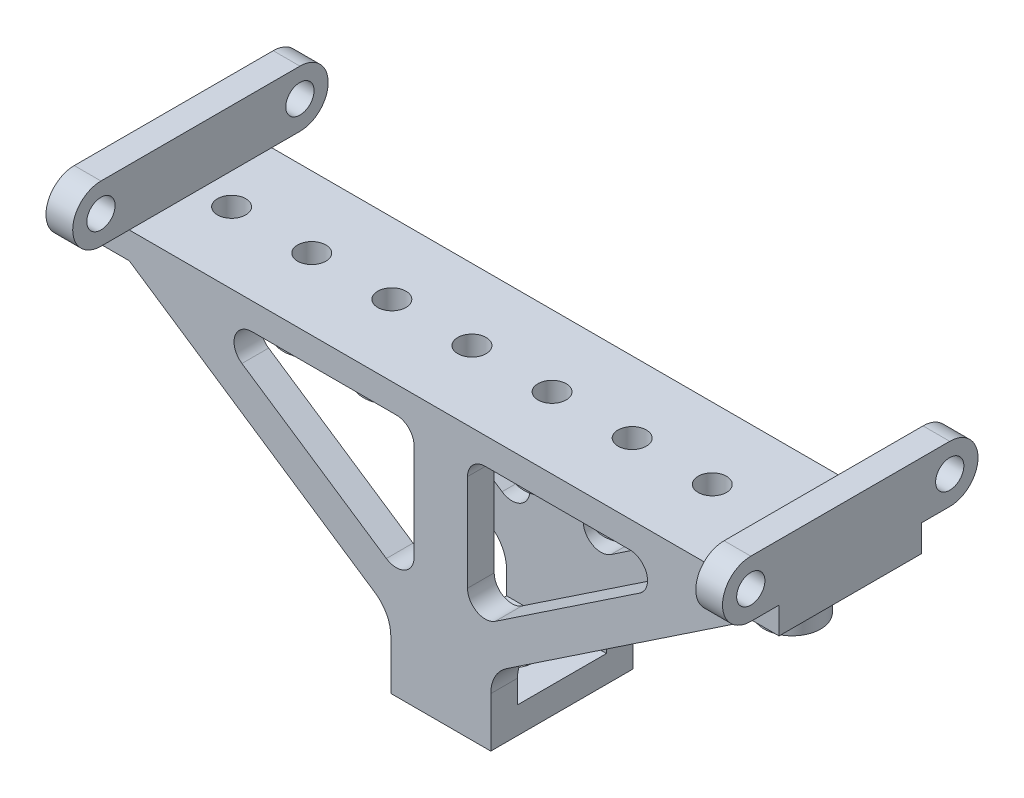
from build123d import *

# Parameters (mm, degrees)
SKETCH1_W            = 70
SKETCH1_H            = 16
SKETCH1_R            = 1.5875
BOSS_EXTRUDE1_DEPTH  = 3
BOSS_EXTRUDE6_DEPTH  = 3
BOSS_EXTRUDE9_START  = -3
BOSS_EXTRUDE9_DEPTH  = 3
SKETCH7_W            = 11.213160903
SKETCH7_H            = 16
SKETCH7_R            = 2.413
BOSS_EXTRUDE10_DEPTH = 3
SKETCH10_R           = 1.5875
BOSS_EXTRUDE11_DEPTH = 3
BOSS_EXTRUDE12_START = 3
SKETCH11_R           = 1.5875
BOSS_EXTRUDE12_DEPTH = 3
SKETCH12_R           = 3.175
SKETCH12_R_2         = 1.5875
BOSS_EXTRUDE13_DEPTH = 5


with BuildPart() as part:
    # Sketch1 → Boss-Extrude1 (new body)
    with BuildSketch(Plane(origin=(0, 0, 0), x_dir=(1, 0, 0), z_dir=(0, 1, 0))):
        Rectangle(SKETCH1_W, SKETCH1_H)
        with Locations(Location((-4.5, 0, 0), (0, 0, 270))):
            Circle(SKETCH1_R, mode=Mode.SUBTRACT)
        with Locations(Location((4.5, 0, 0), (0, 0, 270))):
            Circle(SKETCH1_R, mode=Mode.SUBTRACT)
        with Locations(Location((13.5, 0, 0), (0, 0, 270))):
            Circle(SKETCH1_R, mode=Mode.SUBTRACT)
        with Locations(Location((22.5, 0, 0), (0, 0, 270))):
            Circle(SKETCH1_R, mode=Mode.SUBTRACT)
        with Locations(Location((31.5, 0, 0), (0, 0, 270))):
            Circle(SKETCH1_R, mode=Mode.SUBTRACT)
        with Locations(Location((-13.5, 0, 0), (0, 0, 270))):
            Circle(SKETCH1_R, mode=Mode.SUBTRACT)
        with Locations(Location((-22.5, 0, 0), (0, 0, 270))):
            Circle(SKETCH1_R, mode=Mode.SUBTRACT)
        with Locations(Location((-31.5, 0, 0), (0, 0, 270))):
            Circle(SKETCH1_R, mode=Mode.SUBTRACT)
    extrude(amount=-BOSS_EXTRUDE1_DEPTH)

    # Sketch3 → Boss-Extrude6 (add)
    with BuildSketch(Plane(origin=(0, 0, -8), x_dir=(-1, 0, 0), z_dir=(0, 0, -1))):
        with BuildLine():
            ThreePointArc((-7.390034655, -21.480696382), (-6.086556875, -22.920616292), (-5.615003916, -24.804776975))
            Line((-5.615003916, -24.804776975), (-5.615003916, -30.4))
            Line((-5.615003916, -30.4), (5.615003916, -30.4))
            Line((5.615003916, -30.4), (5.615003916, -24.804776975))
            ThreePointArc((5.615003916, -24.804776975), (6.086556875, -22.920616292), (7.390034655, -21.480696382))
            Line((7.390034655, -21.480696382), (35, -3))
            Line((35, -3), (35, 0))
            Line((35, 0), (-35, 0))
            Line((-35, 0), (-35, -3))
            Line((-35, -3), (-7.390034655, -21.480696382))
        make_face()
        with BuildLine():
            Line((-6.11248463, -17.522461887), (-22.337839864, -6.662040296))
            ThreePointArc((-22.337839864, -6.662040296), (-23.139001046, -4.418656983), (-21.225355233, -3))
            Line((-21.225355233, -3), (-5, -3))
            ThreePointArc((-5, -3), (-3.585786438, -3.585786438), (-3, -5))
            Line((-3, -5), (-3, -15.860421591))
            ThreePointArc((-3, -15.860421591), (-4.057919659, -17.624645111), (-6.11248463, -17.522461887))
        make_face(mode=Mode.SUBTRACT)
        with BuildLine():
            Line((3, -15.860421591), (3, -5))
            ThreePointArc((3, -5), (3.585786438, -3.585786438), (5, -3))
            Line((5, -3), (21.225355233, -3))
            ThreePointArc((21.225355233, -3), (23.139001046, -4.418656983), (22.337839864, -6.662040296))
            Line((22.337839864, -6.662040296), (6.11248463, -17.522461887))
            ThreePointArc((6.11248463, -17.522461887), (4.057919659, -17.624645111), (3, -15.860421591))
        make_face(mode=Mode.SUBTRACT)
    extrude(amount=-BOSS_EXTRUDE6_DEPTH)

    # Sketch6 → Boss-Extrude9 (add)
    with BuildSketch(Plane.XY.offset(8).offset(BOSS_EXTRUDE9_START)):
        with BuildLine():
            ThreePointArc((-7.390034655, -21.480696382), (-6.086556875, -22.920616292), (-5.615003916, -24.804776975))
            Line((-5.615003916, -24.804776975), (-5.615003916, -30.4))
            Line((-5.615003916, -30.4), (5.615003916, -30.4))
            Line((5.615003916, -30.4), (5.615003916, -24.804776975))
            ThreePointArc((5.615003916, -24.804776975), (6.086556875, -22.920616292), (7.390034655, -21.480696382))
            Line((7.390034655, -21.480696382), (35, -3))
            Line((35, -3), (35, 0))
            Line((35, 0), (-35, 0))
            Line((-35, 0), (-35, -3))
            Line((-35, -3), (-7.390034655, -21.480696382))
        make_face()
        with BuildLine():
            Line((-6.11248463, -17.522461887), (-22.337839864, -6.662040296))
            ThreePointArc((-22.337839864, -6.662040296), (-23.139001046, -4.418656983), (-21.225355233, -3))
            Line((-21.225355233, -3), (-5, -3))
            ThreePointArc((-5, -3), (-3.585786438, -3.585786438), (-3, -5))
            Line((-3, -5), (-3, -15.860421591))
            ThreePointArc((-3, -15.860421591), (-4.057919659, -17.624645111), (-6.11248463, -17.522461887))
        make_face(mode=Mode.SUBTRACT)
        with BuildLine():
            Line((3, -15.860421591), (3, -5))
            ThreePointArc((3, -5), (3.585786438, -3.585786438), (5, -3))
            Line((5, -3), (21.225355233, -3))
            ThreePointArc((21.225355233, -3), (23.139001046, -4.418656983), (22.337839864, -6.662040296))
            Line((22.337839864, -6.662040296), (6.11248463, -17.522461887))
            ThreePointArc((6.11248463, -17.522461887), (4.057919659, -17.624645111), (3, -15.860421591))
        make_face(mode=Mode.SUBTRACT)
    extrude(amount=BOSS_EXTRUDE9_DEPTH)

    # Sketch7 → Boss-Extrude10 (add)
    with BuildSketch(Plane.XZ.offset(30.4)):
        with Locations((0.008423464, 0)):
            Rectangle(SKETCH7_W, SKETCH7_H)
        Circle(SKETCH7_R, mode=Mode.SUBTRACT)
    extrude(amount=-BOSS_EXTRUDE10_DEPTH)

    # Sketch10 → Boss-Extrude11 (add)
    with BuildSketch(Plane(origin=(35, 0, 0), x_dir=(0, 0, -1), z_dir=(1, 0, 0))):
        with BuildLine():
            Line((-11.175, 0), (-8, 0))
            Line((-8, 0), (-8, -3))
            Line((-8, -3), (8, -3))
            Line((8, -3), (8, 0))
            Line((8, 0), (11.175, 0))
            ThreePointArc((11.175, 0), (14.35, 3.175), (11.175, 6.35))
            Line((11.175, 6.35), (-11.175, 6.35))
            ThreePointArc((-11.175, 6.35), (-14.35, 3.175), (-11.175, 0))
        make_face()
        with Locations(Location((11.175, 3.175, 0), (0, 0, 180))):
            Circle(SKETCH10_R, mode=Mode.SUBTRACT)
        with Locations((-11.175, 3.175)):
            Circle(SKETCH10_R, mode=Mode.SUBTRACT)
    extrude(amount=BOSS_EXTRUDE11_DEPTH)

    # Sketch11 → Boss-Extrude12 (add)
    with BuildSketch(Plane.ZY.offset(35).offset(BOSS_EXTRUDE12_START)):
        with BuildLine():
            Line((-11.175, 0), (-8, 0))
            Line((-8, 0), (-8, -3))
            Line((-8, -3), (8, -3))
            Line((8, -3), (8, 0))
            Line((8, 0), (11.175, 0))
            ThreePointArc((11.175, 0), (14.35, 3.175), (11.175, 6.35))
            Line((11.175, 6.35), (-11.175, 6.35))
            ThreePointArc((-11.175, 6.35), (-14.35, 3.175), (-11.175, 0))
        make_face()
        with Locations(Location((11.175, 3.175, 0), (0, 0, 180))):
            Circle(SKETCH11_R, mode=Mode.SUBTRACT)
        with Locations((-11.175, 3.175)):
            Circle(SKETCH11_R, mode=Mode.SUBTRACT)
    extrude(amount=-BOSS_EXTRUDE12_DEPTH)

    # Sketch12 → Boss-Extrude13 (add)
    # profile 1 of 8: a face of its own
    with BuildSketch(Plane.XZ.offset(3)):
        with Locations(Location((-31.5, 0, 0), (0, 0, 270))):
            Circle(SKETCH12_R)
        with Locations(Location((-31.5, 0, 0), (0, 0, 90))):
            Circle(SKETCH12_R_2, mode=Mode.SUBTRACT)
    # profile 2 of 8: a face of its own
    with BuildSketch(Plane.XZ.offset(3)):
        with Locations(Location((-22.5, 0, 0), (0, 0, 270))):
            Circle(SKETCH12_R)
        with Locations(Location((-22.5, 0, 0), (0, 0, 90))):
            Circle(SKETCH12_R_2, mode=Mode.SUBTRACT)
    # profile 3 of 8: a face of its own
    with BuildSketch(Plane.XZ.offset(3)):
        with Locations(Location((-13.5, 0, 0), (0, 0, 270))):
            Circle(SKETCH12_R)
        with Locations(Location((-13.5, 0, 0), (0, 0, 90))):
            Circle(SKETCH12_R_2, mode=Mode.SUBTRACT)
    # profile 4 of 8: a face of its own
    with BuildSketch(Plane.XZ.offset(3)):
        with Locations(Location((-4.5, 0, 0), (0, 0, 270))):
            Circle(SKETCH12_R)
        with Locations(Location((-4.5, 0, 0), (0, 0, 90))):
            Circle(SKETCH12_R_2, mode=Mode.SUBTRACT)
    # profile 5 of 8: a face of its own
    with BuildSketch(Plane.XZ.offset(3)):
        with Locations(Location((4.5, 0, 0), (0, 0, 270))):
            Circle(SKETCH12_R)
        with Locations(Location((4.5, 0, 0), (0, 0, 90))):
            Circle(SKETCH12_R_2, mode=Mode.SUBTRACT)
    # profile 6 of 8: a face of its own
    with BuildSketch(Plane.XZ.offset(3)):
        with Locations(Location((13.5, 0, 0), (0, 0, 270))):
            Circle(SKETCH12_R)
        with Locations(Location((13.5, 0, 0), (0, 0, 90))):
            Circle(SKETCH12_R_2, mode=Mode.SUBTRACT)
    # profile 7 of 8: a face of its own
    with BuildSketch(Plane.XZ.offset(3)):
        with Locations(Location((22.5, 0, 0), (0, 0, 270))):
            Circle(SKETCH12_R)
        with Locations(Location((22.5, 0, 0), (0, 0, 90))):
            Circle(SKETCH12_R_2, mode=Mode.SUBTRACT)
    # profile 8 of 8: a face of its own
    with BuildSketch(Plane.XZ.offset(3)):
        with Locations(Location((31.5, 0, 0), (0, 0, 270))):
            Circle(SKETCH12_R)
        with Locations(Location((31.5, 0, 0), (0, 0, 90))):
            Circle(SKETCH12_R_2, mode=Mode.SUBTRACT)
    extrude(amount=BOSS_EXTRUDE13_DEPTH)


solid = part.part
